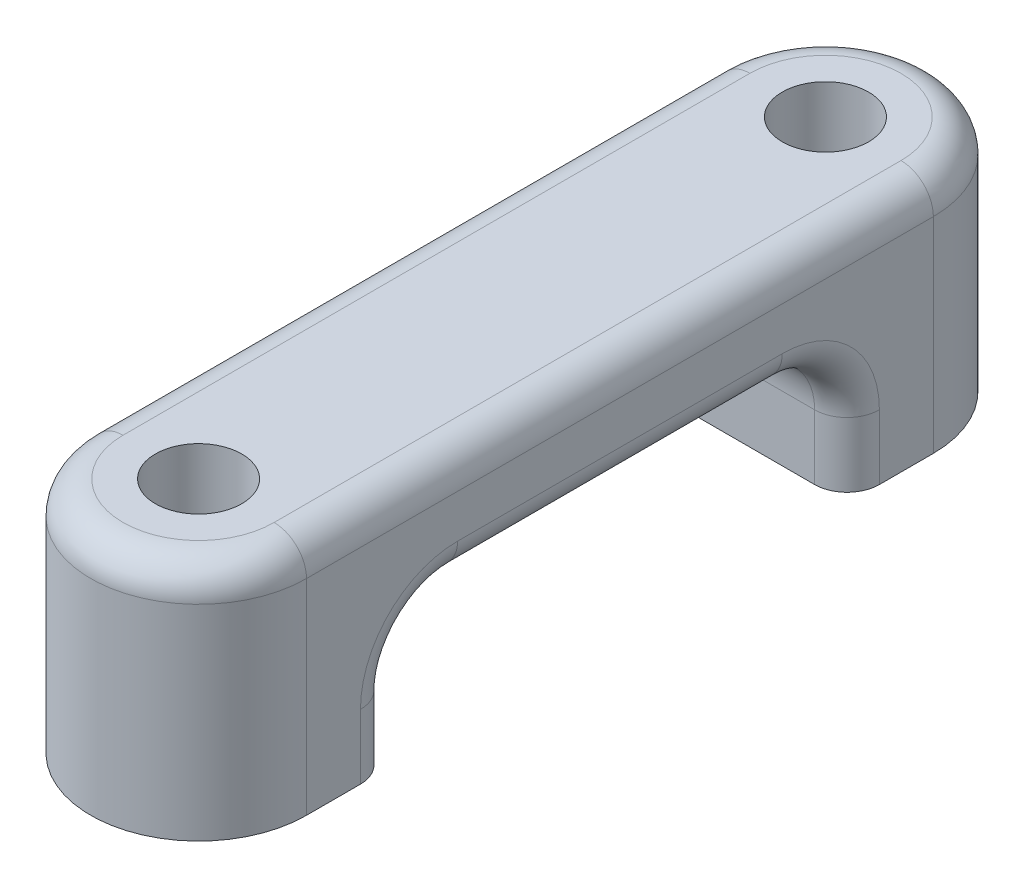
from build123d import *
from build123d.topology import SkipClean

# Parameters (mm, degrees)
SKETCH1_R           = 2
BOSS_EXTRUDE1_DEPTH = 5
BOSS_EXTRUDE2_START = 6
SKETCH2_R           = 2
BOSS_EXTRUDE2_DEPTH = 6
FILLET2_R           = 3
FILLET1_R           = 1.5


with BuildPart() as part:
    # Sketch1 → Boss-Extrude1 (new body)
    with BuildSketch(Plane(origin=(0, 0, 0), x_dir=(1, 0, 0), z_dir=(0, 1, 0))):
        with BuildLine():
            Line((-5, -14.5206785), (-5, 14.5206785))
            ThreePointArc((-5, 14.5206785), (0, 19.5206785), (5, 14.5206785))
            Line((5, 14.5206785), (5, -14.5206785))
            ThreePointArc((5, -14.5206785), (0, -19.5206785), (-5, -14.5206785))
        make_face()
        with Locations(Location((0, 14.5206785, 0), (0, 0, 270))):
            Circle(SKETCH1_R, mode=Mode.SUBTRACT)
        with Locations(Location((0, -14.5206785, 0), (0, 0, 90))):
            Circle(SKETCH1_R, mode=Mode.SUBTRACT)
    extrude(amount=BOSS_EXTRUDE1_DEPTH)

    # Sketch2 → Boss-Extrude2 (add)
    # profile 1 of 2: a face of its own
    with SkipClean():  # the faces are left unmerged after this step: merging them gives an invalid solid
        with BuildSketch(Plane.XZ.offset(BOSS_EXTRUDE2_START)):
            with BuildLine():
                Line((-5, -10.5206785), (5, -10.5206785))
                Line((5, -10.5206785), (5, -14.5206785))
                ThreePointArc((5, -14.5206785), (0, -19.5206785), (-5, -14.5206785))
                Line((-5, -14.5206785), (-5, -10.5206785))
            make_face()
            with Locations(Location((0, -14.5206785, 0), (0, 0, 270))):
                Circle(SKETCH2_R, mode=Mode.SUBTRACT)
        # profile 2 of 2: a face of its own
        with BuildSketch(Plane.XZ.offset(BOSS_EXTRUDE2_START)):
            with BuildLine():
                Line((-5, 10.5206785), (5, 10.5206785))
                Line((5, 10.5206785), (5, 14.5206785))
                ThreePointArc((5, 14.5206785), (0, 19.5206785), (-5, 14.5206785))
                Line((-5, 14.5206785), (-5, 10.5206785))
            make_face()
            with Locations(Location((0, 14.5206785, 0), (0, 0, 270))):
                Circle(SKETCH2_R, mode=Mode.SUBTRACT)
        extrude(amount=-BOSS_EXTRUDE2_DEPTH)

    # Fillet2
    fillet2_edges = [part.edges().sort_by_distance(p)[0] for p in [
        (0, 0, -10.5206785),
        (0, 0, 10.5206785),
    ]]
    fillet(fillet2_edges, radius=FILLET2_R)

    # Fillet1
    fillet1_edges = [part.edges().sort_by_distance(p)[0] for p in [
        (0, 5, 19.5206785),
        (5, 5, 0),
        (-5, -4.5, -10.5206785),
        (5, -4.5, -10.5206785),
        (-5, -4.5, 10.5206785),
        (5, -4.5, 10.5206785),
        (0, 5, -19.5206785),
        (5, 0, 0),
        (-5, 0, 0),
        (-5, -0.878679656, -9.641998844),
        (5, -0.878679656, -9.641998844),
        (5, -0.878679656, 9.641998844),
        (-5, -0.878679656, 9.641998844),
        (-5, 5, 0),
    ]]
    fillet(fillet1_edges, radius=FILLET1_R)


solid = part.part
